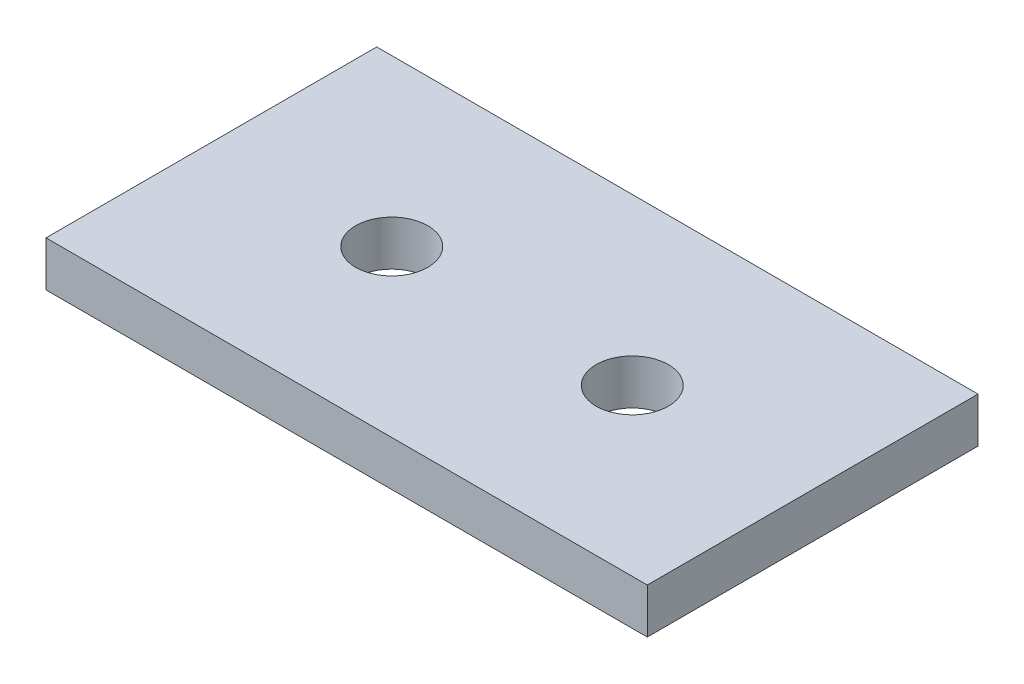
from build123d import *

# Parameters (mm, degrees)
SKETCH1_W           = 20
SKETCH1_H           = 11
BOSS_EXTRUDE1_DEPTH = 1.5
SKETCH2_R           = 1.2
CUT_EXTRUDE1_DEPTH  = 1.5


with BuildPart() as part:
    # Sketch1 → Boss-Extrude1 (new body)
    with BuildSketch(Plane(origin=(0, 0, 0), x_dir=(1, 0, 0), z_dir=(0, 1, 0))):
        with Locations((-10, 0)):
            Rectangle(SKETCH1_W, SKETCH1_H)
    extrude(amount=-BOSS_EXTRUDE1_DEPTH)

    # Sketch2 → Cut-Extrude1 (cut)
    with BuildSketch(Plane(origin=(0, 0, 0), x_dir=(1, 0, 0), z_dir=(0, 1, 0))):
        with Locations(Location((-6, 0, 0), (0, 0, 270))):
            Circle(SKETCH2_R)
        with Locations(Location((-14, 0, 0), (0, 0, 270))):
            Circle(SKETCH2_R)
    extrude(amount=-CUT_EXTRUDE1_DEPTH, mode=Mode.SUBTRACT)


solid = part.part
